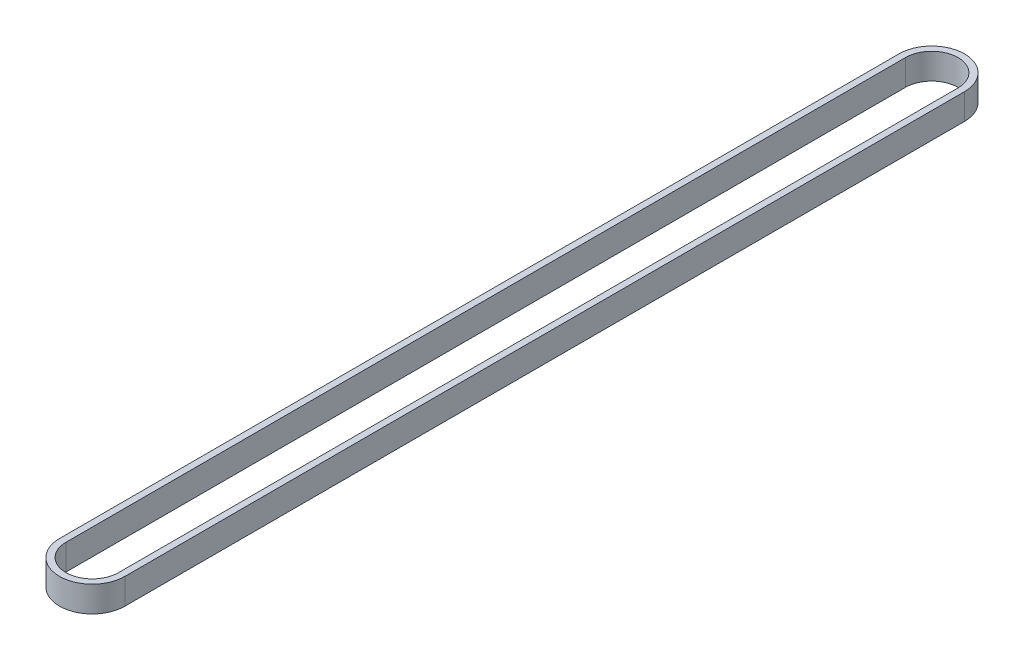
from build123d import *

# Parameters (mm, degrees)
EXTRUDE_1_DEPTH = 6


with BuildPart() as part:
    # 草图1 → 凸台-拉伸1 (new body)
    with BuildSketch(Plane(origin=(0, 0, 0), x_dir=(1, 0, 0), z_dir=(0, 1, 0))):
        with BuildLine():
            Line((-7.61, -97.55), (-7.61, 97.55))
            ThreePointArc((-7.61, 97.55), (0, 105.16), (7.61, 97.55))
            Line((7.61, 97.55), (7.61, -97.55))
            ThreePointArc((7.61, -97.55), (0, -105.16), (-7.61, -97.55))
        make_face()
        with BuildLine():
            Line((-6.11, -97.55), (-6.11, 97.55))
            ThreePointArc((-6.11, 97.55), (0, 103.66), (6.11, 97.55))
            Line((6.11, 97.55), (6.11, -97.55))
            ThreePointArc((6.11, -97.55), (0, -103.66), (-6.11, -97.55))
        make_face(mode=Mode.SUBTRACT)
    extrude(amount=EXTRUDE_1_DEPTH)


solid = part.part
